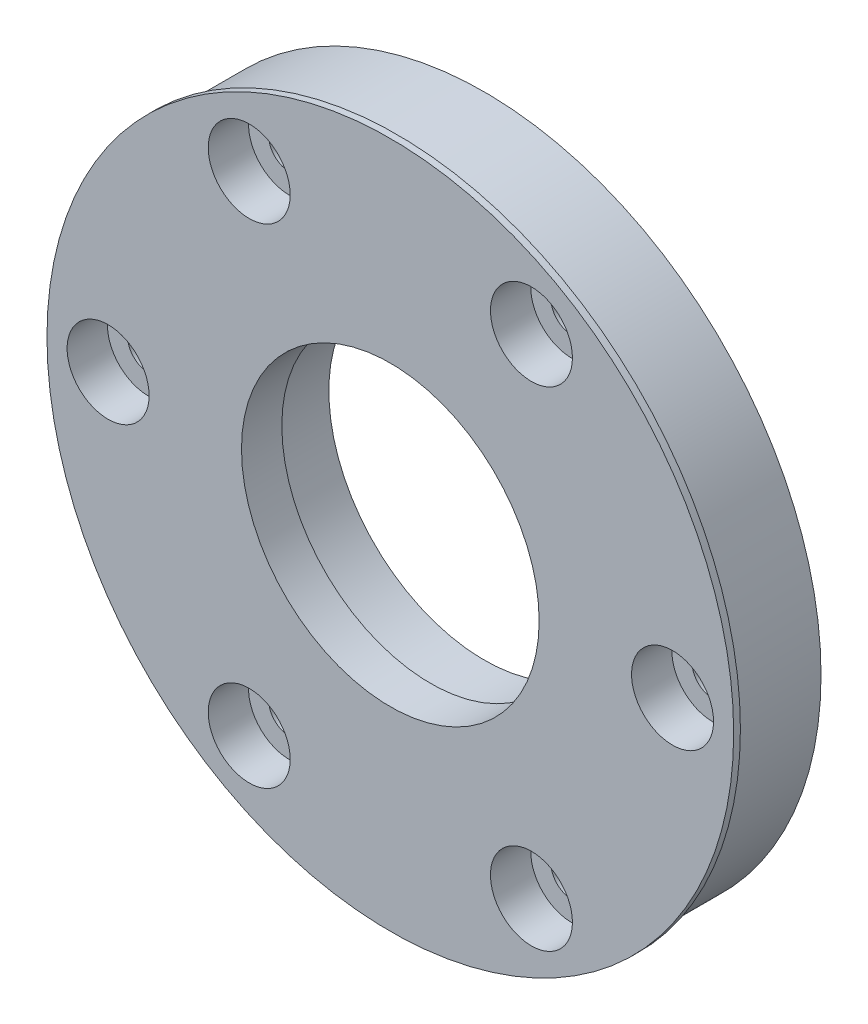
from build123d import *

# Parameters (mm, degrees)
SKETCH2_R                           = 25.05
BOSS_EXTRUDE1_DEPTH                 = 7
SKETCH3_R                           = 3.05
DOWEL_PIN_CUTOUT_DEPTH              = 3
MAIN_START                          = -0.5
SKETCH4_R                           = 25.55
SKETCH4_R_2                         = 25.05
MAIN_HOUSING_BEARING_RETAINER_DEPTH = 0.5
SKETCH5_R                           = 1.55
M3_THRU_DEPTH                       = 37.804958905
SKETCH6_R                           = 3
M3_BUTTON_HEAD_CUTOUT_DEPTH         = 1.7
SKETCH8_R                           = 11.575
INPUT_SHAFT_BEARING_CUTOUT_DEPTH    = 37.804958905
INPUT_START                         = -7
SKETCH9_R                           = 11.575
SKETCH9_R_2                         = 11.075
INPUT_SHAFT_BEARING_RETAINER_DEPTH  = 3


with BuildPart() as part:
    # Sketch2 → Boss-Extrude1 (new body)
    with BuildSketch(Plane.XY):
        Circle(SKETCH2_R)
    extrude(amount=BOSS_EXTRUDE1_DEPTH)

    # Sketch3 → Dowel Pin Cutout (cut)
    with BuildSketch(Plane.XY.offset(7)):
        with Locations((-21, 0)):
            Circle(SKETCH3_R)
        with Locations((-10.5, 18.186533479)):
            Circle(SKETCH3_R)
        with Locations((10.5, 18.186533479)):
            Circle(SKETCH3_R)
        with Locations((21, 0)):
            Circle(SKETCH3_R)
        with Locations((10.5, -18.186533479)):
            Circle(SKETCH3_R)
        with Locations((-10.5, -18.186533479)):
            Circle(SKETCH3_R)
    extrude(amount=-DOWEL_PIN_CUTOUT_DEPTH, mode=Mode.SUBTRACT)

    # Sketch4 → Main Housing Bearing Retainer (add)
    with BuildSketch(Plane.XY.offset(7).offset(MAIN_START)):
        Circle(SKETCH4_R)
        Circle(SKETCH4_R_2, mode=Mode.SUBTRACT)
    extrude(amount=MAIN_HOUSING_BEARING_RETAINER_DEPTH)

    # Sketch5 → M3 Thru (cut, through all)
    with BuildSketch(Plane(origin=(0, 0, 0), x_dir=(-1, 0, 0), z_dir=(0, 0, -1))):
        with Locations((-21, 0)):
            Circle(SKETCH5_R)
        with Locations((-10.5, 18.186533479)):
            Circle(SKETCH5_R)
        with Locations((10.5, 18.186533479)):
            Circle(SKETCH5_R)
        with Locations((21, 0)):
            Circle(SKETCH5_R)
        with Locations((10.5, -18.186533479)):
            Circle(SKETCH5_R)
        with Locations((-10.5, -18.186533479)):
            Circle(SKETCH5_R)
    extrude(amount=-M3_THRU_DEPTH, mode=Mode.SUBTRACT)

    # Sketch6 → M3 Button Head Cutout (cut)
    with BuildSketch(Plane(origin=(0, 0, 0), x_dir=(-1, 0, 0), z_dir=(0, 0, -1))):
        with Locations((-21, 0)):
            Circle(SKETCH6_R)
        with Locations((-10.5, 18.186533479)):
            Circle(SKETCH6_R)
        with Locations((10.5, 18.186533479)):
            Circle(SKETCH6_R)
        with Locations((21, 0)):
            Circle(SKETCH6_R)
        with Locations((10.5, -18.186533479)):
            Circle(SKETCH6_R)
        with Locations((-10.5, -18.186533479)):
            Circle(SKETCH6_R)
    extrude(amount=-M3_BUTTON_HEAD_CUTOUT_DEPTH, mode=Mode.SUBTRACT)

    # Sketch8 → Input Shaft Bearing Cutout (cut, through all)
    with BuildSketch(Plane.XY.offset(7)):
        Circle(SKETCH8_R)
    extrude(amount=-INPUT_SHAFT_BEARING_CUTOUT_DEPTH, mode=Mode.SUBTRACT)

    # Sketch9 → Input Shaft Bearing Retainer (add)
    with BuildSketch(Plane(origin=(0, 0, 0), x_dir=(-1, 0, 0), z_dir=(0, 0, -1)).offset(INPUT_START)):
        with Locations(Location((0, 0, 0), (0, 0, 180))):
            Circle(SKETCH9_R)
        with Locations(Location((0, 0, 0), (0, 0, 180))):
            Circle(SKETCH9_R_2, mode=Mode.SUBTRACT)
    extrude(amount=INPUT_SHAFT_BEARING_RETAINER_DEPTH)


solid = part.part
